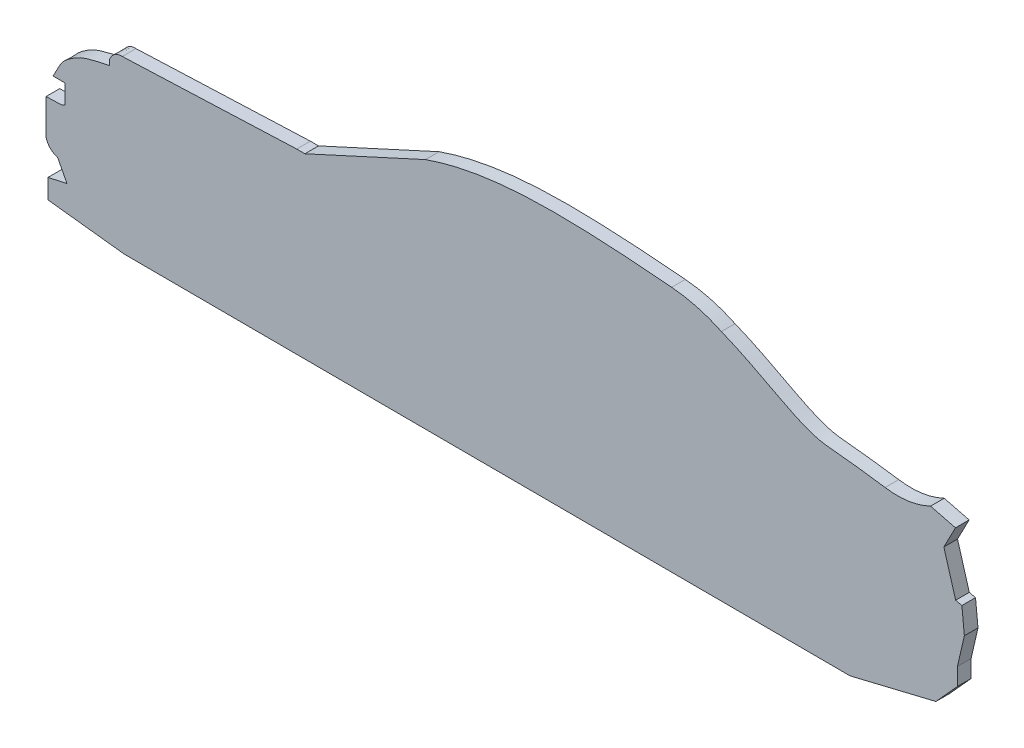
from build123d import *

# Parameters (mm, degrees)
BOSS_EXTRUDE1_DEPTH = 3.18


with BuildPart() as part:
    # Sketch1 → Boss-Extrude1 (new body)
    with BuildSketch(Plane.XY):
        with BuildLine():
            Line((-126.90183157, 63.451351123), (-155.002649134, 50.576))
            Line((-155.002649134, 50.576), (-156.915085055, 50.576))
            Line((-156.915085055, 50.576), (-197.532680285, 48.933631486))
            add(Edge.make_bspline(
                [(-197.532680285, 48.933631486), (-197.856938216, 48.954758252), (-198.175689042, 48.919514289), (-198.799707333, 48.740420096), (-199.089269759, 48.60100182), (-199.619237435, 48.22712778), (-199.847302364, 48.001548224), (-200.130777612, 47.605564254), (-200.213431577, 47.466364131), (-200.354340024, 47.173676097), (-200.419958888, 47.025100819), (-200.487796099, 46.87754919)],
                knots=[0, 0, 0, 0, 0.25, 0.25, 0.5, 0.5, 0.75, 0.75, 0.875, 0.875, 1, 1, 1, 1], degree=3))
            Line((-200.487796099, 46.87754919), (-200.487796099, 45.619190287))
            add(Edge.make_bspline(
                [(-200.487796099, 45.619190287), (-201.175292403, 45.504495406), (-201.855658011, 45.358549214), (-202.871912486, 45.120811128), (-203.209958375, 45.038472689), (-203.885830998, 44.872835338), (-204.223958167, 44.790853124), (-205.235951458, 44.534439775), (-205.906487656, 44.346277621), (-206.874996959, 43.986286634), (-207.191831701, 43.853034452), (-207.811823525, 43.556321951), (-208.418924997, 43.231140141), (-209.00527456, 42.860126187), (-209.584167639, 42.472644028), (-209.869399807, 42.273387637), (-210.694020174, 41.643506759), (-211.201483238, 41.178004532), (-211.73013182, 40.482204306), (-211.831050549, 40.336542937), (-212.018083165, 40.036660904), (-212.101621784, 39.881329534), (-212.681033882, 38.791115208), (-213.177672823, 37.856645785), (-213.674311764, 36.922176363)],
                knots=[0, 0, 0, 0, 0.125, 0.125, 0.1875, 0.1875, 0.25, 0.25, 0.375, 0.375, 0.4375, 0.4375, 0.5, 0.5625, 0.5625, 0.625, 0.625, 0.75, 0.75, 0.78125, 0.78125, 0.8125, 0.8125, 1, 1, 1, 1], degree=3))
            Line((-213.674311764, 36.922176363), (-210.877284017, 36.922176363))
            Line((-210.877284017, 36.922176363), (-210.877284017, 32.540772436))
            add(Edge.make_bspline(
                [(-210.877284017, 32.540772436), (-211.01960291, 32.409346329), (-211.181627568, 32.308403793), (-211.398218963, 32.203976442), (-211.442536276, 32.184489252), (-211.532145699, 32.153014843), (-211.577730345, 32.141242749), (-211.715600825, 32.111602843), (-211.80902927, 32.099543954), (-212.09120418, 32.072973702), (-212.281306192, 32.068469044), (-212.660362358, 32.06338607), (-212.849968469, 32.063384257), (-213.229001172, 32.057537609), (-213.418366995, 32.04971484), (-214.175802907, 32.017532543), (-214.743879841, 31.99339582), (-215.311956775, 31.969259097)],
                knots=[0, 0, 0, 0, 0.125, 0.125, 0.15625, 0.15625, 0.1875, 0.1875, 0.25, 0.25, 0.375, 0.375, 0.5, 0.5, 0.625, 0.625, 1, 1, 1, 1], degree=3))
            Line((-215.311956775, 31.969259097), (-215.311956775, 23.771206966))
            add(Edge.make_bspline(
                [(-215.311956775, 23.771206966), (-215.252651766, 23.614087197), (-215.195691348, 23.455737729), (-215.069051829, 23.145447933), (-214.998440356, 22.994452742), (-214.840114463, 22.702195632), (-214.75241985, 22.56092244), (-214.557151858, 22.289689045), (-214.448883791, 22.159284686), (-214.102194357, 21.800368316), (-213.838466215, 21.600407707), (-213.3989114, 21.353484525), (-213.247390183, 21.281360686), (-212.937649457, 21.155492936), (-212.778720347, 21.102500321), (-212.618220712, 21.053354457)],
                knots=[0, 0, 0, 0, 0.125, 0.125, 0.25, 0.25, 0.375, 0.375, 0.5, 0.5, 0.75, 0.75, 0.875, 0.875, 1, 1, 1, 1], degree=3))
            Line((-212.618220712, 21.053354457), (-210.413324841, 16.852708496))
            Line((-210.413324841, 16.852708496), (-214.842666667, 15.890688618))
            Line((-214.842666667, 15.890688618), (-214.842666667, 11.337489634))
            Line((-214.842666667, 11.337489634), (-197.102804327, 9.286029209))
            Line((-197.102804327, 9.286029209), (-28.009214442, 8.739519054))
            Line((-28.009214442, 8.739519054), (-8.008995649, 13.571514777))
            Line((-8.008995649, 13.571514777), (-3.000125196, 19.110373285))
            Line((-3.000125196, 19.110373285), (-3.000125196, 23.150277734))
            Line((-3.000125196, 23.150277734), (-1.385458215, 30.1458802))
            Line((-1.385458215, 30.1458802), (-1.963054434, 35.965465751))
            Line((-1.963054434, 35.965465751), (-3.410277854, 36.299501866))
            Line((-3.410277854, 36.299501866), (-6.15958565, 45.672965506))
            Line((-6.15958565, 45.672965506), (-3.451467886, 50.891534117))
            Line((-3.451467886, 50.891534117), (-9.2540276, 52.359494102))
            add(Edge.make_bspline(
                [(-9.2540276, 52.359494102), (-9.668938039, 52.177193353), (-10.082311797, 51.990757567), (-10.923946882, 51.657946755), (-11.350787182, 51.507747905), (-12.21693651, 51.240902135), (-12.656745199, 51.124231149), (-13.541049299, 50.927055953), (-13.986464066, 50.846222), (-14.883749808, 50.719684722), (-15.336640435, 50.673980514), (-16.239784909, 50.617569956), (-16.690860317, 50.606663408), (-18.042684657, 50.622754962), (-18.942033937, 50.698486568), (-19.839725309, 50.831943658)],
                knots=[0, 0, 0, 0, 0.125, 0.125, 0.25, 0.25, 0.375, 0.375, 0.5, 0.5, 0.625, 0.625, 0.75, 0.75, 1, 1, 1, 1], degree=3))
            add(Edge.make_bspline(
                [(-19.839725309, 50.831943658), (-23.196389637, 51.361628621), (-26.571655772, 51.738977688), (-30.372384718, 52.134386137), (-30.794736233, 52.177924879), (-31.639473894, 52.264718753), (-32.062038009, 52.307465354), (-33.326315143, 52.447060744), (-34.164847593, 52.554482825), (-35.806204141, 52.888039932), (-36.604486091, 53.1292754), (-38.181447383, 53.676915497), (-38.958811115, 53.987693889), (-41.268211651, 54.995464511), (-42.778587948, 55.7679407), (-45.783734721, 57.329402218), (-47.281168214, 58.120620227), (-51.793167154, 60.454082238), (-54.828124104, 61.954720164), (-57.978327556, 63.220213351)],
                knots=[0, 0, 0, 0, 0.25, 0.25, 0.28125, 0.28125, 0.3125, 0.3125, 0.375, 0.375, 0.4375, 0.4375, 0.5, 0.5, 0.625, 0.625, 0.75, 0.75, 1, 1, 1, 1], degree=3))
            add(Edge.make_bspline(
                [(-57.978327556, 63.220213351), (-59.798164817, 64.087622794), (-61.68095051, 64.789239178), (-65.573057504, 65.841379817), (-67.564024776, 66.185499955), (-69.57343092, 66.350830453)],
                knots=[0, 0, 0, 0, 0.5, 0.5, 1, 1, 1, 1], degree=3))
            add(Edge.make_bspline(
                [(-69.57343092, 66.350830453), (-70.776224616, 66.4631), (-71.980092265, 66.560752996), (-74.387874583, 66.755419067), (-75.591630106, 66.854598111), (-79.20418242, 67.134636215), (-81.61486975, 67.289764959), (-86.440099172, 67.547559017), (-88.853422865, 67.655029171), (-93.681704146, 67.795356063), (-96.096777782, 67.827180782), (-100.929760736, 67.774306212), (-103.340330508, 67.689526026), (-108.134351858, 67.365368434), (-110.519298799, 67.12601353), (-115.259021268, 66.454036055), (-117.613803047, 66.021453535), (-121.118607544, 65.197268693), (-122.282311533, 64.893303875), (-124.599756422, 64.221554126), (-125.753229336, 63.852052568), (-126.90183157, 63.451351123)],
                knots=[0, 0, 0, 0, 0.0625, 0.0625, 0.125, 0.125, 0.25, 0.25, 0.375, 0.375, 0.5, 0.5, 0.625, 0.625, 0.75, 0.75, 0.875, 0.875, 0.9375, 0.9375, 1, 1, 1, 1], degree=3))
        make_face()
    extrude(amount=BOSS_EXTRUDE1_DEPTH)


solid = part.part
